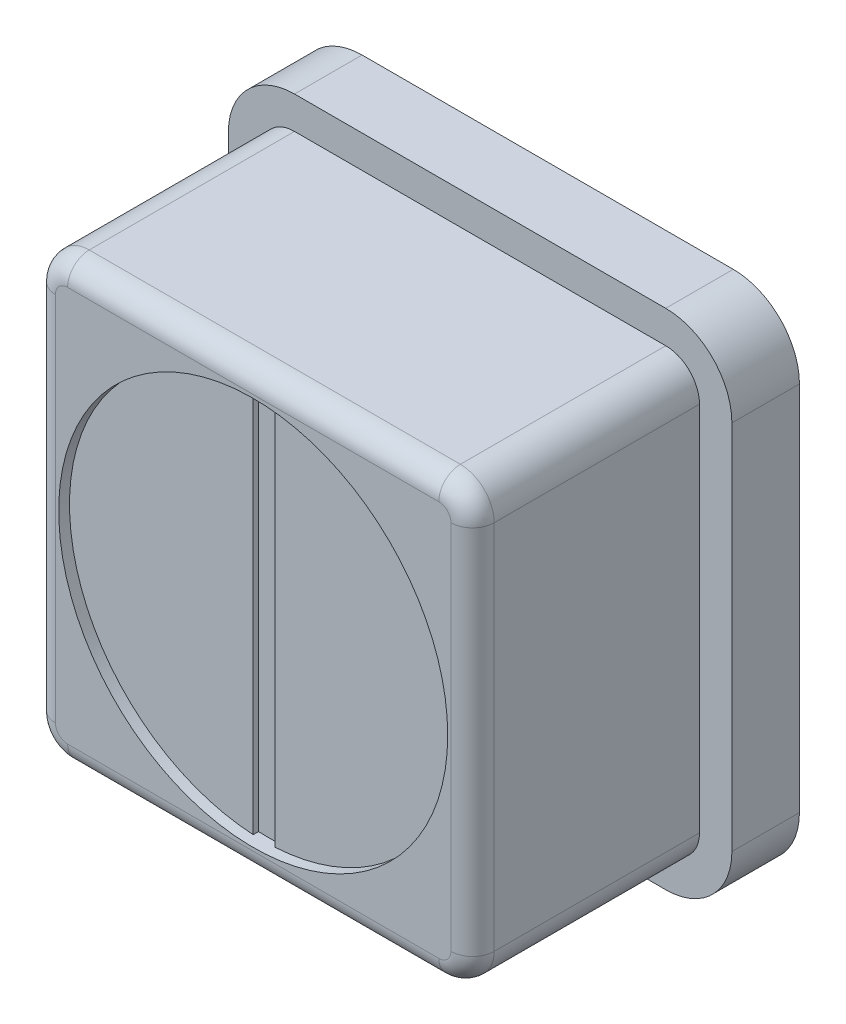
from build123d import *

# Parameters (mm, degrees)
BOSS_EXTRUDE1_DEPTH              = 5.334
FILLET1_R                        = 0.508
SKETCH2_R                        = 4.572
CUT_EXTRUDE1_DEPTH               = 0.254
CUT_EXTRUDE2_DEPTH               = 0.127
BOSS_EXTRUDE2_DEPTH              = 1.5875
F_56_0_0465_DIAMETER_HOLE1_D     = 1.1811
F_56_0_0465_DIAMETER_HOLE1_DEPTH = 5.08


with BuildPart() as part:
    # Sketch1 → Boss-Extrude1 (new body)
    with BuildSketch(Plane.XY):
        with BuildLine():
            Line((4.362446893, 5.156199954), (-4.362446893, 5.156199954))
            ThreePointArc((-4.362446893, 5.156199954), (-4.923713797, 4.923718126), (-5.156199954, 4.362453015))
            Line((-5.156199954, 4.362453015), (-5.156199954, -4.362453015))
            ThreePointArc((-5.156199954, -4.362453015), (-4.923714856, -4.923717067), (-4.362449887, -5.156199954))
            Line((-4.362449887, -5.156199954), (4.362449887, -5.156199954))
            ThreePointArc((4.362449887, -5.156199954), (4.92371702, -4.923714903), (5.156199954, -4.362446893))
            Line((5.156199954, -4.362446893), (5.156199954, 4.362446893))
            ThreePointArc((5.156199954, 4.362446893), (4.923715961, 4.923715962), (4.362446893, 5.156199954))
        make_face()
    extrude(amount=-BOSS_EXTRUDE1_DEPTH)

    # Fillet1
    fillet1_edges = [part.edges().sort_by_distance(p)[0] for p in [
        (0, 5.156199954, 0),
        (4.923715961, 4.923715962, 0),
        (5.156199954, 0, 0),
        (4.92371702, -4.923714903, 0),
        (0, -5.156199954, 0),
        (-4.923714856, -4.923717067, 0),
        (-5.156199954, 0, 0),
        (-4.923713797, 4.923718126, 0),
    ]]
    fillet(fillet1_edges, radius=FILLET1_R)

    # Sketch2 → Cut-Extrude1 (cut)
    with BuildSketch(Plane.XY):
        Circle(SKETCH2_R)
    extrude(amount=-CUT_EXTRUDE1_DEPTH, mode=Mode.SUBTRACT)

    # Sketch3 → Cut-Extrude2 (cut)
    with BuildSketch(Plane.XY.offset(-0.254)):
        with BuildLine():
            ThreePointArc((-0.254, -4.564938992), (0, -4.572), (0.254, -4.564938992))
            Line((0.254, -4.564938992), (0.254, 4.564938992))
            ThreePointArc((0.254, 4.564938992), (0, 4.572), (-0.254, 4.564938992))
            Line((-0.254, 4.564938992), (-0.254, -4.564938992))
        make_face()
    extrude(amount=-CUT_EXTRUDE2_DEPTH, mode=Mode.SUBTRACT)

    # Sketch4 → Boss-Extrude2 (add)
    with BuildSketch(Plane(origin=(0, 0, -5.334), x_dir=(-1, 0, 0), z_dir=(0, 0, -1))):
        with BuildLine():
            Line((-5.918199954, 4.362443955), (-5.918199954, -4.362446893))
            ThreePointArc((-5.918199954, -4.362446893), (-5.462532364, -5.462530293), (-4.362449822, -5.918199954))
            Line((-4.362449822, -5.918199954), (4.362449887, -5.918199954))
            ThreePointArc((4.362449887, -5.918199954), (5.462529184, -5.462533474), (5.918199954, -4.362455953))
            Line((5.918199954, -4.362455953), (5.918199954, 4.362453015))
            ThreePointArc((5.918199954, 4.362453015), (5.462528126, 5.462534532), (4.362443955, 5.918199954))
            Line((4.362443955, 5.918199954), (-4.362443955, 5.918199954))
            ThreePointArc((-4.362443955, 5.918199954), (-5.462531329, 5.462531329), (-5.918199954, 4.362443955))
        make_face()
    extrude(amount=BOSS_EXTRUDE2_DEPTH)

    # #56 (0.0465) Diameter Hole1
    with Locations(Plane(origin=(0, 0, -6.9215), x_dir=(-1, 0, 0), z_dir=(0, 0, -1))):
        with Locations((0, 0)):
            Hole(F_56_0_0465_DIAMETER_HOLE1_D / 2, depth=F_56_0_0465_DIAMETER_HOLE1_DEPTH)


solid = part.part
